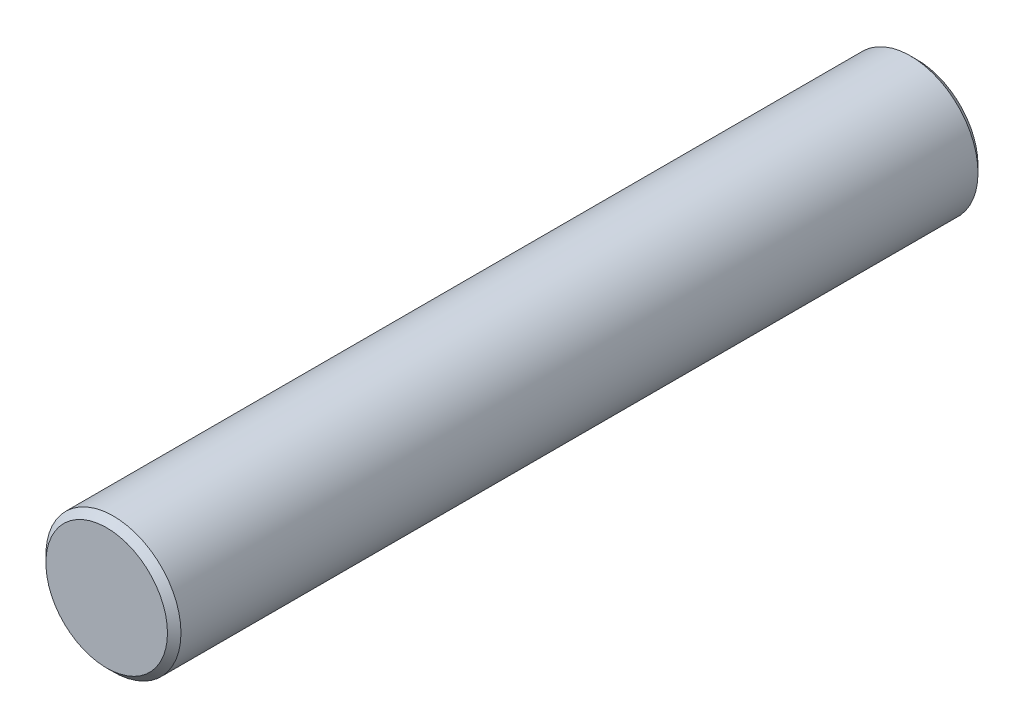
from build123d import *

# Parameters (mm, degrees)
SKETCH1_R           = 1
BOSS_EXTRUDE1_DEPTH = 6
CHAMFER1_SIZE       = 0.1


with BuildPart() as part:
    # Sketch1 → Boss-Extrude1 (new, symmetric)
    with BuildSketch(Plane.XY):
        Circle(SKETCH1_R)
    extrude(amount=BOSS_EXTRUDE1_DEPTH, both=True)

    # Chamfer1
    chamfer1_edges = [part.edges().sort_by_distance(p)[0] for p in [
        (-1, 0, -6),
        (-1, 0, 6),
    ]]
    chamfer(chamfer1_edges, length=CHAMFER1_SIZE)


solid = part.part
